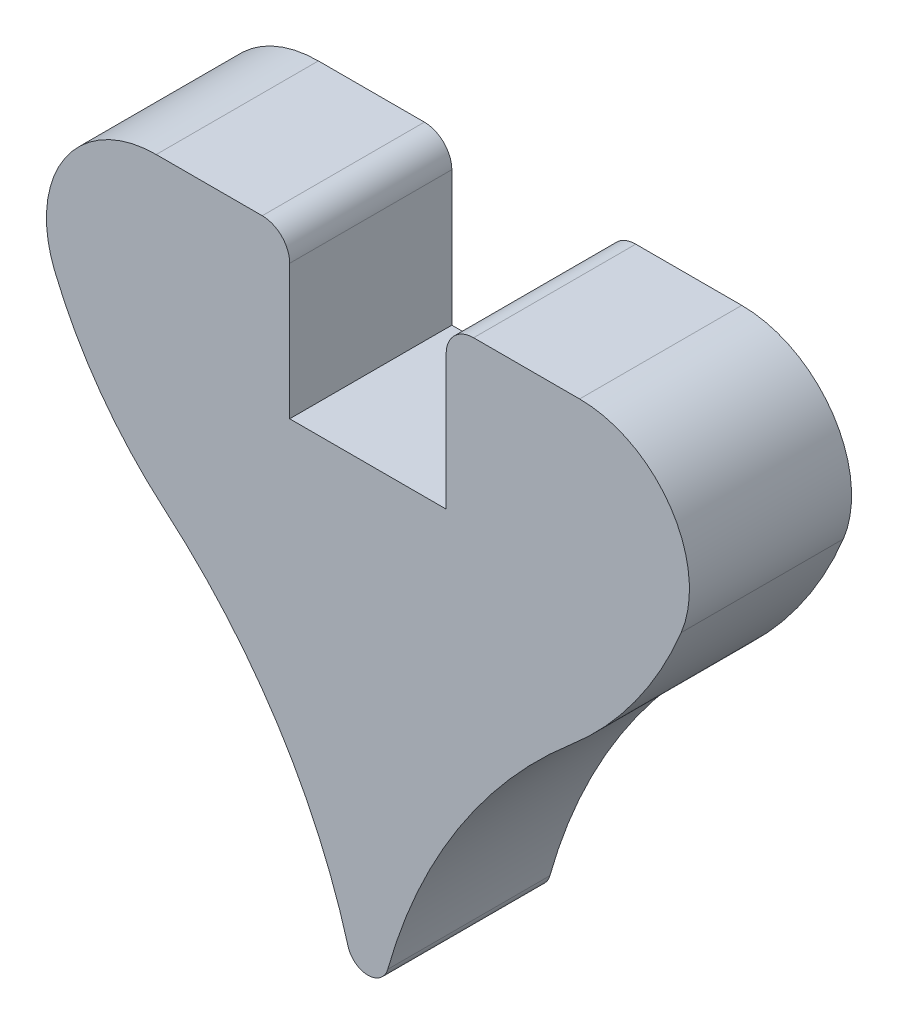
from build123d import *

# Parameters (mm, degrees)
EXTRUDE_1_DEPTH = 3
FILLET_1_R      = 0.381
FILLET_2_R      = 2.032
FILLET_3_R      = 0.508


with BuildPart() as part:
    # 스케치1 → 보스-돌출1 (new body)
    with BuildSketch(Plane.XY):
        with BuildLine():
            ThreePointArc((6.35, 3.529721173), (5.670280833, 0.435941066), (3.756321038, -2.08799463))
            ThreePointArc((3.756321038, -2.08799463), (1.146216202, -5.391882357), (0, -9.443364775))
            ThreePointArc((0, -9.443364775), (-1.146216202, -5.391882357), (-3.756321038, -2.08799463))
            ThreePointArc((-3.756321038, -2.08799463), (-5.670280833, 0.435941066), (-6.35, 3.529721173))
            Line((-6.35, 3.529721173), (-1.4475, 3.529721173))
            Line((-1.4475, 3.529721173), (-1.4475, 0.529721173))
            Line((-1.4475, 0.529721173), (1.4475, 0.529721173))
            Line((1.4475, 0.529721173), (1.4475, 3.529721173))
            Line((1.4475, 3.529721173), (6.35, 3.529721173))
        make_face()
    extrude(amount=EXTRUDE_1_DEPTH)

    # 필렛1
    fillet_1_edges = [part.edges().sort_by_distance(p)[0] for p in [
        (0, -9.443364775, 1.5),
    ]]
    fillet(fillet_1_edges, radius=FILLET_1_R)

    # 필렛2
    fillet_2_edges = [part.edges().sort_by_distance(p)[0] for p in [
        (-6.35, 3.529721173, 1.5),
        (6.35, 3.529721173, 1.5),
    ]]
    fillet(fillet_2_edges, radius=FILLET_2_R)

    # 필렛3
    fillet_3_edges = [part.edges().sort_by_distance(p)[0] for p in [
        (-1.4475, 3.529721173, 1.5),
        (1.4475, 3.529721173, 1.5),
    ]]
    fillet(fillet_3_edges, radius=FILLET_3_R)


solid = part.part
